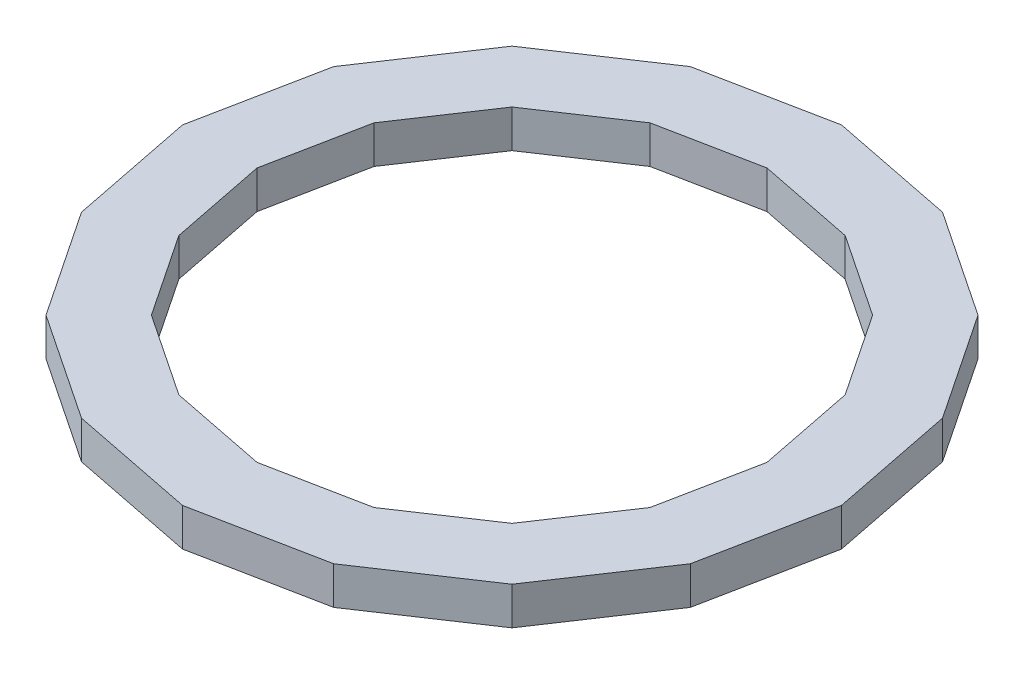
from build123d import *

# Parameters (mm, degrees)
BOSS_EXTRUDE1_DEPTH = 19.05


with BuildPart() as part:
    # Sketch1 → Boss-Extrude1 (new body)
    with BuildSketch(Plane(origin=(0, 0, 0), x_dir=(1, 0, 0), z_dir=(0, 1, 0))):
        Polygon((166.00003355, 0), (153.364033393, 63.525462612), (117.379749401, 117.379749401), (63.525462612, 153.364033393), (0, 166.00003355), (-63.525462612, 153.364033393), (-117.379749401, 117.379749401), (-153.364033393, 63.525462612), (-166.00003355, 0), (-153.364033393, -63.525462612), (-117.379749401, -117.379749401), (-63.525462612, -153.364033393), (0, -166.00003355), (63.525462612, -153.364033393), (117.379749401, -117.379749401), (153.364033393, -63.525462612), align=None)
        Polygon((128.448491193, 0), (118.670931996, 49.155109492), (90.826799156, 90.826799156), (49.155109492, 118.670931996), (0, 128.448491193), (-49.155109492, 118.670931996), (-90.826799156, 90.826799156), (-118.670931996, 49.155109492), (-128.448491193, 0), (-118.670931996, -49.155109492), (-90.826799156, -90.826799156), (-49.155109492, -118.670931996), (0, -128.448491193), (49.155109492, -118.670931996), (90.826799156, -90.826799156), (118.670931996, -49.155109492), align=None, mode=Mode.SUBTRACT)
    extrude(amount=BOSS_EXTRUDE1_DEPTH)


solid = part.part
